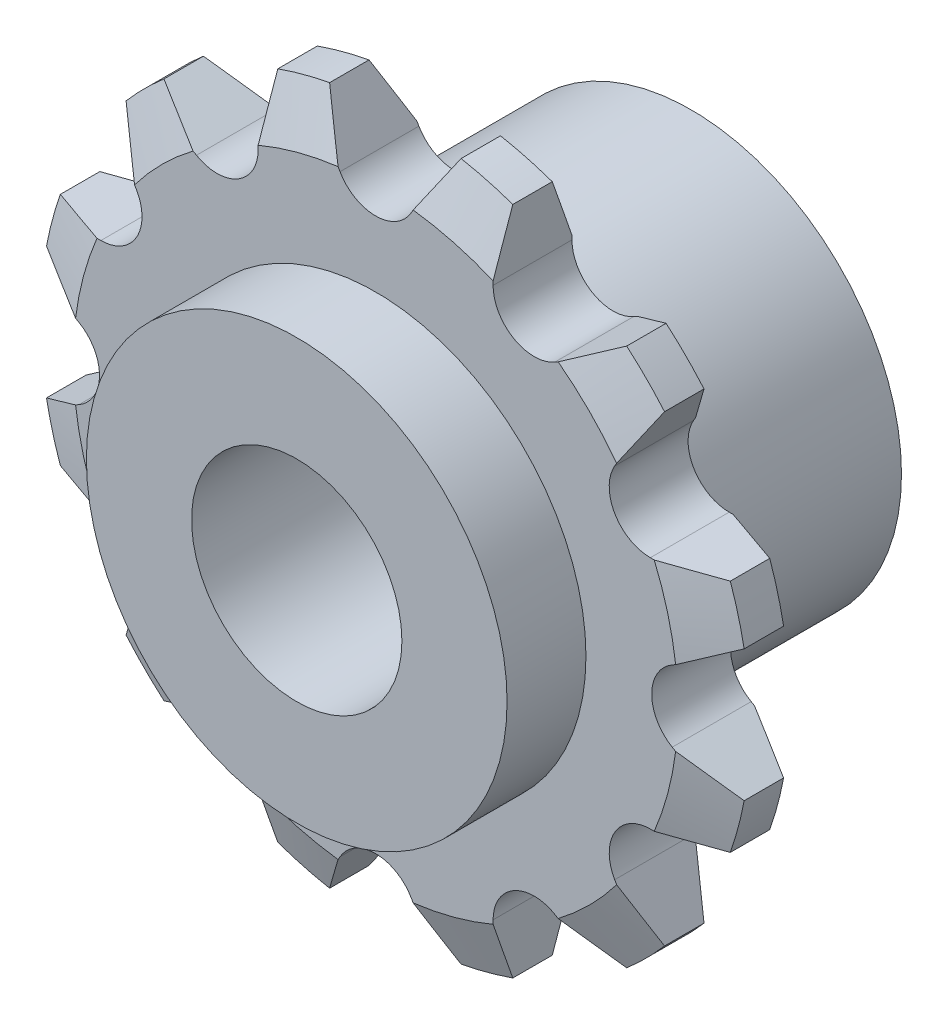
from build123d import *

# Parameters (mm, degrees)
CUT_EXTRUDE1_DEPTH = 23.549944568


with BuildPart() as part:
    # Sketch1 → Revolve1 (revolve)
    with BuildSketch(Plane(origin=(0, 0, 0), x_dir=(1, 0, 0), z_dir=(0, 1, 0)), mode=Mode.PRIVATE) as revolve1_sk:
        Polygon((-4, 0), (-8, 0), (-8, 3), (-11.5, 3), (-13.5, 3.75), (-13.5, 5.25), (-11.5, 6), (-8, 6), (-8, 15), (-4, 15), align=None)
    revolve(revolve1_sk.sketch.rotate(Axis((0, 0, 0), (0, 0, -1)), 180), axis=Axis((0, 0, 0), (0, 0, -1)))

    # Sketch2 → Cut-Extrude1 (cut, through all)
    with BuildSketch(Plane.XY.offset(-3)):
        with BuildLine():
            Line((-2.5, 13.266499161), (-1.354141447, 11.281813929))
            ThreePointArc((-1.354141447, 11.281813929), (0, 10.5), (1.354141447, 11.281813929))
            Line((1.354141447, 11.281813929), (2.5, 13.266499161))
            ThreePointArc((2.5, 13.266499161), (0, 13.5), (-2.5, 13.266499161))
        make_face()
        with BuildLine():
            Line((4.468186071, 12.739125293), (4.468186071, 10.447408186))
            ThreePointArc((4.468186071, 10.447408186), (5.25, 9.09326674), (6.813627858, 9.09326674))
            Line((6.813627858, 9.09326674), (8.79831309, 10.239125293))
            ThreePointArc((8.79831309, 10.239125293), (6.75, 11.691342951), (4.468186071, 12.739125293))
        make_face()
        with BuildLine():
            Line((10.239125293, 8.79831309), (9.09326674, 6.813627858))
            ThreePointArc((9.09326674, 6.813627858), (9.09326674, 5.25), (10.447408186, 4.468186071))
            Line((10.447408186, 4.468186071), (12.739125293, 4.468186071))
            ThreePointArc((12.739125293, 4.468186071), (11.691342951, 6.75), (10.239125293, 8.79831309))
        make_face()
        with BuildLine():
            Line((13.266499161, 2.5), (11.281813929, 1.354141447))
            ThreePointArc((11.281813929, 1.354141447), (10.5, 0), (11.281813929, -1.354141447))
            Line((11.281813929, -1.354141447), (13.266499161, -2.5))
            ThreePointArc((13.266499161, -2.5), (13.5, 0), (13.266499161, 2.5))
        make_face()
        with BuildLine():
            Line((12.739125293, -4.468186071), (10.447408186, -4.468186071))
            ThreePointArc((10.447408186, -4.468186071), (9.09326674, -5.25), (9.09326674, -6.813627858))
            Line((9.09326674, -6.813627858), (10.239125293, -8.79831309))
            ThreePointArc((10.239125293, -8.79831309), (11.691342951, -6.75), (12.739125293, -4.468186071))
        make_face()
        with BuildLine():
            Line((8.79831309, -10.239125293), (6.813627858, -9.09326674))
            ThreePointArc((6.813627858, -9.09326674), (5.25, -9.09326674), (4.468186071, -10.447408186))
            Line((4.468186071, -10.447408186), (4.468186071, -12.739125293))
            ThreePointArc((4.468186071, -12.739125293), (6.75, -11.691342951), (8.79831309, -10.239125293))
        make_face()
        with BuildLine():
            Line((2.5, -13.266499161), (1.354141447, -11.281813929))
            ThreePointArc((1.354141447, -11.281813929), (0, -10.5), (-1.354141447, -11.281813929))
            Line((-1.354141447, -11.281813929), (-2.5, -13.266499161))
            ThreePointArc((-2.5, -13.266499161), (0, -13.5), (2.5, -13.266499161))
        make_face()
        with BuildLine():
            Line((-4.468186071, -12.739125293), (-4.468186071, -10.447408186))
            ThreePointArc((-4.468186071, -10.447408186), (-5.25, -9.09326674), (-6.813627858, -9.09326674))
            Line((-6.813627858, -9.09326674), (-8.79831309, -10.239125293))
            ThreePointArc((-8.79831309, -10.239125293), (-6.75, -11.691342951), (-4.468186071, -12.739125293))
        make_face()
        with BuildLine():
            Line((-10.239125293, -8.79831309), (-9.09326674, -6.813627858))
            ThreePointArc((-9.09326674, -6.813627858), (-9.09326674, -5.25), (-10.447408186, -4.468186071))
            Line((-10.447408186, -4.468186071), (-12.739125293, -4.468186071))
            ThreePointArc((-12.739125293, -4.468186071), (-11.691342951, -6.75), (-10.239125293, -8.79831309))
        make_face()
        with BuildLine():
            Line((-13.266499161, -2.5), (-11.281813929, -1.354141447))
            ThreePointArc((-11.281813929, -1.354141447), (-10.5, 0), (-11.281813929, 1.354141447))
            Line((-11.281813929, 1.354141447), (-13.266499161, 2.5))
            ThreePointArc((-13.266499161, 2.5), (-13.5, 0), (-13.266499161, -2.5))
        make_face()
        with BuildLine():
            Line((-12.739125293, 4.468186071), (-10.447408186, 4.468186071))
            ThreePointArc((-10.447408186, 4.468186071), (-9.09326674, 5.25), (-9.09326674, 6.813627858))
            Line((-9.09326674, 6.813627858), (-10.239125293, 8.79831309))
            ThreePointArc((-10.239125293, 8.79831309), (-11.691342951, 6.75), (-12.739125293, 4.468186071))
        make_face()
        with BuildLine():
            Line((-8.79831309, 10.239125293), (-6.813627858, 9.09326674))
            ThreePointArc((-6.813627858, 9.09326674), (-5.25, 9.09326674), (-4.468186071, 10.447408186))
            Line((-4.468186071, 10.447408186), (-4.468186071, 12.739125293))
            ThreePointArc((-4.468186071, 12.739125293), (-6.75, 11.691342951), (-8.79831309, 10.239125293))
        make_face()
    extrude(amount=-CUT_EXTRUDE1_DEPTH, mode=Mode.SUBTRACT)


solid = part.part
